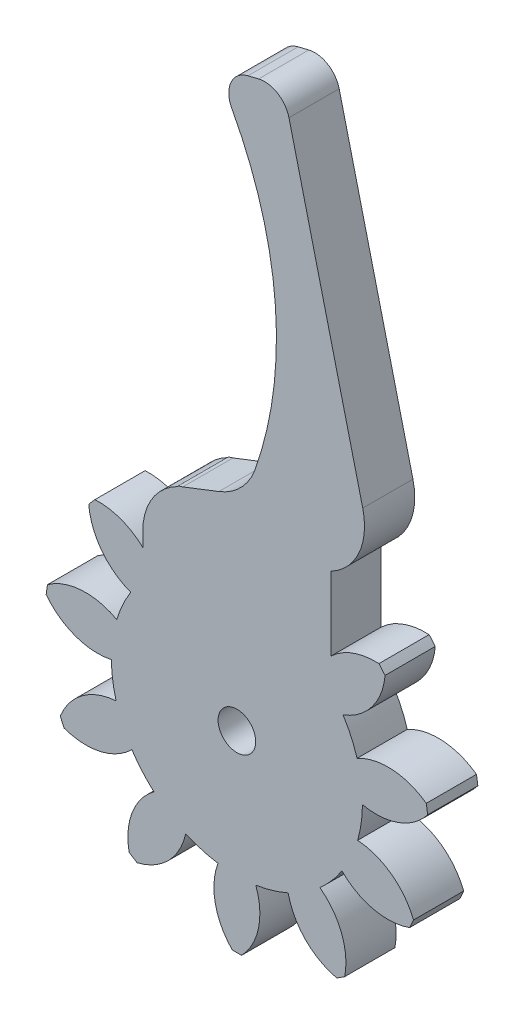
from build123d import *

# Parameters (mm, degrees)
SKETCH_1_R      = 1.5
EXTRUDE_1_DEPTH = 4
EXTRUDE_START   = -4
SKETCH_2_R      = 1.5
EXTRUDE_2_DEPTH = 4


with BuildPart() as part:
    # Эскиз1 → Бобышка-Вытянуть1 (new body)
    with BuildSketch(Plane.XY):
        with BuildLine():
            ThreePointArc((14.071260881, -6.013492872), (12.319653053, -3.733490841), (9.621977893, -2.738961818))
            ThreePointArc((9.621977893, -2.738961818), (9.902389121, -1.423748614), (10.003874897, -0.082809815))
            ThreePointArc((10.003874897, -0.082809815), (12.872466462, 0.111410875), (15.195472667, 1.805571852))
            ThreePointArc((15.195472667, 1.805571852), (15.146612375, 2.177754087), (15.088637629, 2.548625862))
            ThreePointArc((15.088637629, 2.548625862), (12.382429194, 3.519694937), (9.575317452, 2.897872688))
            ThreePointArc((9.575317452, 2.897872688), (9.100156446, 4.155902197), (8.460565465, 5.338839053))
            ThreePointArc((8.460565465, 5.338839053), (10.768774621, 7.053105583), (11.807079223, 9.734236463))
            ThreePointArc((11.807079223, 9.734236463), (11.564758421, 10.020920215), (11.315478542, 10.301573893))
            ThreePointArc((11.315478542, 10.301573893), (8.513871556, 9.655402442), (6.488561375, 7.614653091))
            ThreePointArc((6.488561375, 7.614653091), (5.408688398, 8.416083426), (4.231086277, 9.065444244))
            ThreePointArc((4.231086277, 9.065444244), (5.246072926, 11.755489103), (4.67002155, 14.572349777))
            ThreePointArc((4.67002155, 14.572349777), (4.311175381, 14.68251498), (3.949734969, 14.783845))
            ThreePointArc((3.949734969, 14.783845), (1.942219856, 12.725587893), (1.341732908, 9.91383494))
            ThreePointArc((1.341732908, 9.91383494), (0, 10.004217632), (-1.341732908, 9.91383494))
            ThreePointArc((-1.341732908, 9.91383494), (-1.942219856, 12.725587893), (-3.949734969, 14.783845))
            ThreePointArc((-3.949734969, 14.783845), (-4.311175381, 14.68251498), (-4.67002155, 14.572349777))
            ThreePointArc((-4.67002155, 14.572349777), (-5.246072926, 11.755489103), (-4.231086277, 9.065444244))
            ThreePointArc((-4.231086277, 9.065444244), (-5.408688398, 8.416083426), (-6.488561375, 7.614653091))
            ThreePointArc((-6.488561375, 7.614653091), (-8.513871556, 9.655402442), (-11.315478542, 10.301573893))
            ThreePointArc((-11.315478542, 10.301573893), (-11.564758421, 10.020920215), (-11.807079223, 9.734236463))
            ThreePointArc((-11.807079223, 9.734236463), (-10.768774621, 7.053105583), (-8.460565465, 5.338839053))
            ThreePointArc((-8.460565465, 5.338839053), (-9.100156446, 4.155902197), (-9.575317452, 2.897872688))
            ThreePointArc((-9.575317452, 2.897872688), (-12.382429194, 3.519694937), (-15.088637629, 2.548625862))
            ThreePointArc((-15.088637629, 2.548625862), (-15.146612375, 2.177754087), (-15.195472667, 1.805571852))
            ThreePointArc((-15.195472667, 1.805571852), (-12.872466462, 0.111410875), (-10.003874897, -0.082809815))
            ThreePointArc((-10.003874897, -0.082809815), (-9.902389121, -1.423748614), (-9.621977893, -2.738961818))
            ThreePointArc((-9.621977893, -2.738961818), (-12.319653053, -3.733490841), (-14.071260881, -6.013492872))
            ThreePointArc((-14.071260881, -6.013492872), (-13.91952392, -6.356833577), (-13.759410906, -6.696349066))
            ThreePointArc((-13.759410906, -6.696349066), (-10.889241154, -6.865655999), (-8.371024733, -5.478167151))
            ThreePointArc((-8.371024733, -5.478167151), (-7.560683217, -6.551369301), (-6.613728339, -7.506195299))
            ThreePointArc((-6.613728339, -7.506195299), (-8.345474114, -9.801319657), (-8.586358225, -12.666370108))
            ThreePointArc((-8.586358225, -12.666370108), (-8.273084972, -12.873171495), (-7.954833402, -13.072226469))
            ThreePointArc((-7.954833402, -13.072226469), (-5.448758719, -11.662925603), (-4.080433364, -9.134245124))
            ThreePointArc((-4.080433364, -9.134245124), (-2.818513813, -9.598976524), (-1.505666768, -9.89026481))
            ThreePointArc((-1.505666768, -9.89026481), (-1.72166611, -12.757298735), (-0.375347502, -15.297764332))
            ThreePointArc((-0.375347502, -15.297764332), (0, -15.302368421), (0.375347502, -15.297764332))
            ThreePointArc((0.375347502, -15.297764332), (1.72166611, -12.757298735), (1.505666768, -9.89026481))
            ThreePointArc((1.505666768, -9.89026481), (2.818513813, -9.598976524), (4.080433364, -9.134245124))
            ThreePointArc((4.080433364, -9.134245124), (5.448758719, -11.662925603), (7.954833402, -13.072226469))
            ThreePointArc((7.954833402, -13.072226469), (8.273084972, -12.873171495), (8.586358225, -12.666370108))
            ThreePointArc((8.586358225, -12.666370108), (8.345474114, -9.801319657), (6.613728339, -7.506195299))
            ThreePointArc((6.613728339, -7.506195299), (7.560683217, -6.551369301), (8.371024733, -5.478167151))
            ThreePointArc((8.371024733, -5.478167151), (10.889241154, -6.865655999), (13.759410906, -6.696349066))
            ThreePointArc((13.759410906, -6.696349066), (13.91952392, -6.356833577), (14.071260881, -6.013492872))
        make_face()
        Circle(SKETCH_1_R, mode=Mode.SUBTRACT)
    extrude(amount=EXTRUDE_1_DEPTH)

    # Эскиз2 → Бобышка-Вытянуть2 (add)
    with BuildSketch(Plane.XY.offset(4).offset(EXTRUDE_START)):
        with BuildLine():
            Line((-7.5, 10.022081122), (-7.5, 0))
            ThreePointArc((-7.5, 0), (0, -7.5), (7.5, 0))
            Line((7.5, 0), (7.5, 14.773393999))
            ThreePointArc((7.5, 14.773393999), (9.729229581, 17.145166049), (10.026172222, 20.386553445))
            Line((10.026172222, 20.386553445), (4.148462459, 44.386107165))
            ThreePointArc((4.148462459, 44.386107165), (3.243079479, 45.620379181), (1.730114922, 45.852938848))
            Line((1.730114922, 45.852938848), (0.876935531, 45.643987428))
            ThreePointArc((0.876935531, 45.643987428), (-0.475250292, 44.512952898), (-0.407285774, 42.751411973))
            ThreePointArc((-0.407285774, 42.751411973), (3.070511892, 30.857094407), (1.383888162, 18.580076554))
            ThreePointArc((1.383888162, 18.580076554), (0.260030802, 16.89805568), (-1.438297092, 15.798996103))
            Line((-1.438297092, 15.798996103), (-4.311175381, 14.68251498))
            ThreePointArc((-4.311175381, 14.68251498), (-6.62649227, 12.84556506), (-7.5, 10.022081122))
        make_face()
        Circle(SKETCH_2_R, mode=Mode.SUBTRACT)
    extrude(amount=EXTRUDE_2_DEPTH)


solid = part.part
